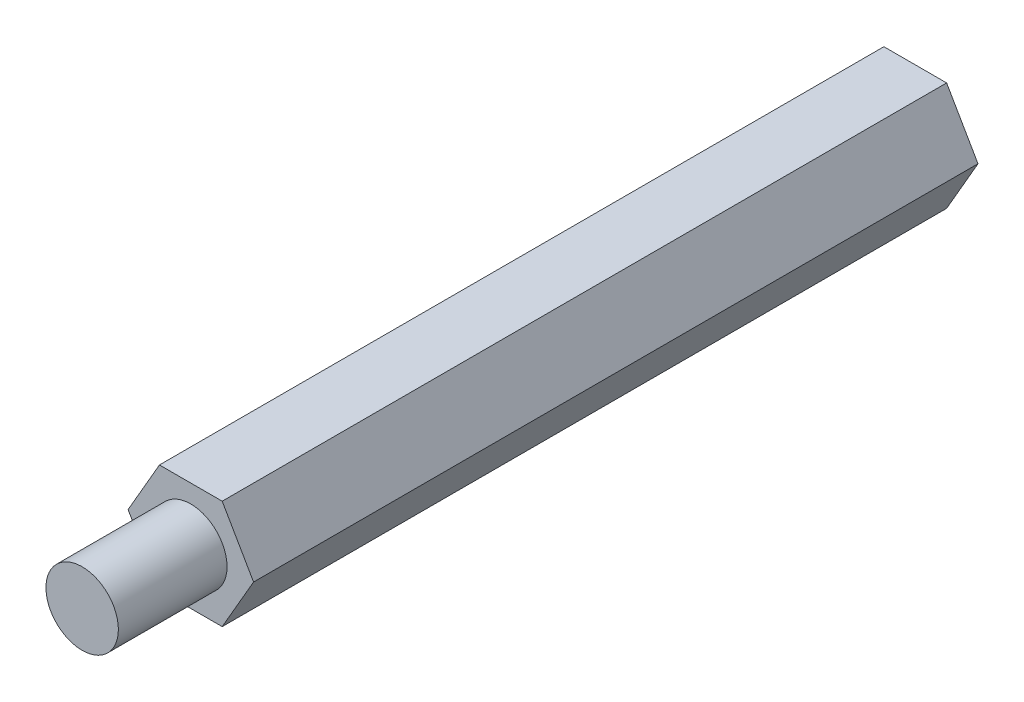
from build123d import *

# Parameters (mm, degrees)
EXTRUDE_1_DEPTH        = 20
SKETCH_2_R             = 1
EXTRUDE_2_DEPTH        = 3
HOLE_WIZARD_M2_1_D     = 2.4
HOLE_WIZARD_M2_1_DEPTH = 3
HOLE_WIZARD_M2_1_TIP   = 0.721032743


with BuildPart() as part:
    # 스케치1 → 보스-돌출1 (new body)
    with BuildSketch(Plane.XY):
        Polygon((0.866025404, -1.5), (1.732050808, 0), (0.866025404, 1.5), (-0.866025404, 1.5), (-1.732050808, 0), (-0.866025404, -1.5), align=None)
    extrude(amount=EXTRUDE_1_DEPTH)

    # 스케치2 → 보스-돌출2 (add)
    with BuildSketch(Plane.XY.offset(20)):
        Circle(SKETCH_2_R)
    extrude(amount=EXTRUDE_2_DEPTH)

    # M2 여유 구멍1
    with Locations(Plane(origin=(0, 0, 0), x_dir=(-1, 0, 0), z_dir=(0, 0, -1))):
        with Locations((0, 0)):
            Hole(HOLE_WIZARD_M2_1_D / 2, depth=HOLE_WIZARD_M2_1_DEPTH)
            with Locations((0, 0, -(HOLE_WIZARD_M2_1_DEPTH + HOLE_WIZARD_M2_1_TIP / 2))):  # 118° drill point
                Cone(0, HOLE_WIZARD_M2_1_D / 2, HOLE_WIZARD_M2_1_TIP, mode=Mode.SUBTRACT)


solid = part.part
